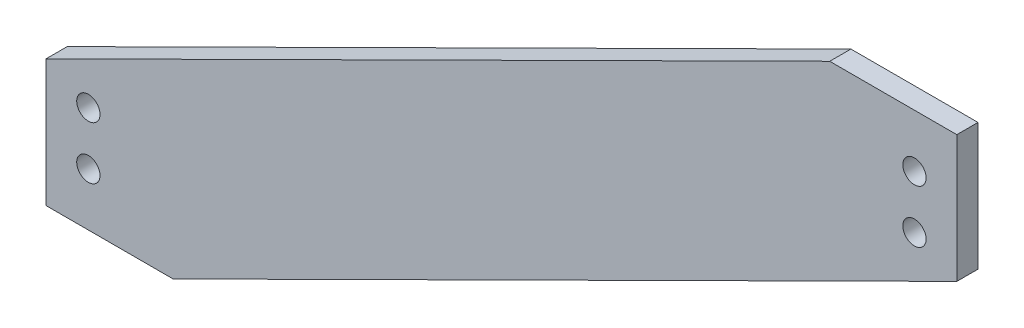
from build123d import *

# Parameters (mm, degrees)
BOSS_EXTRUDE1_DEPTH  = 5
BOSS_EXTRUDE2_DEPTH  = 5
M5_CLEARANCE_HOLE1_D = 5.5


with BuildPart() as part:
    # Sketch1 → Boss-Extrude1 (new body)
    with BuildSketch(Plane.XY):
        Polygon((0, 0), (20, 0), (215, 122), (195, 122), align=None)
    extrude(amount=BOSS_EXTRUDE1_DEPTH)

    # Sketch2 → Boss-Extrude2 (add)
    with BuildSketch(Plane.XY.offset(5)):
        Polygon((0, 0), (0, 30), (185, 122), (195, 122), (215, 122), (215, 92), (30, 0), align=None)
    extrude(amount=-BOSS_EXTRUDE2_DEPTH)

    # M5 Clearance Hole1 (through all)
    with Locations(Plane.XY.offset(5)):
        with Locations((205, 97), (10, 25), (10, 12.5), (205, 109.5)):
            Hole(M5_CLEARANCE_HOLE1_D / 2)


solid = part.part
